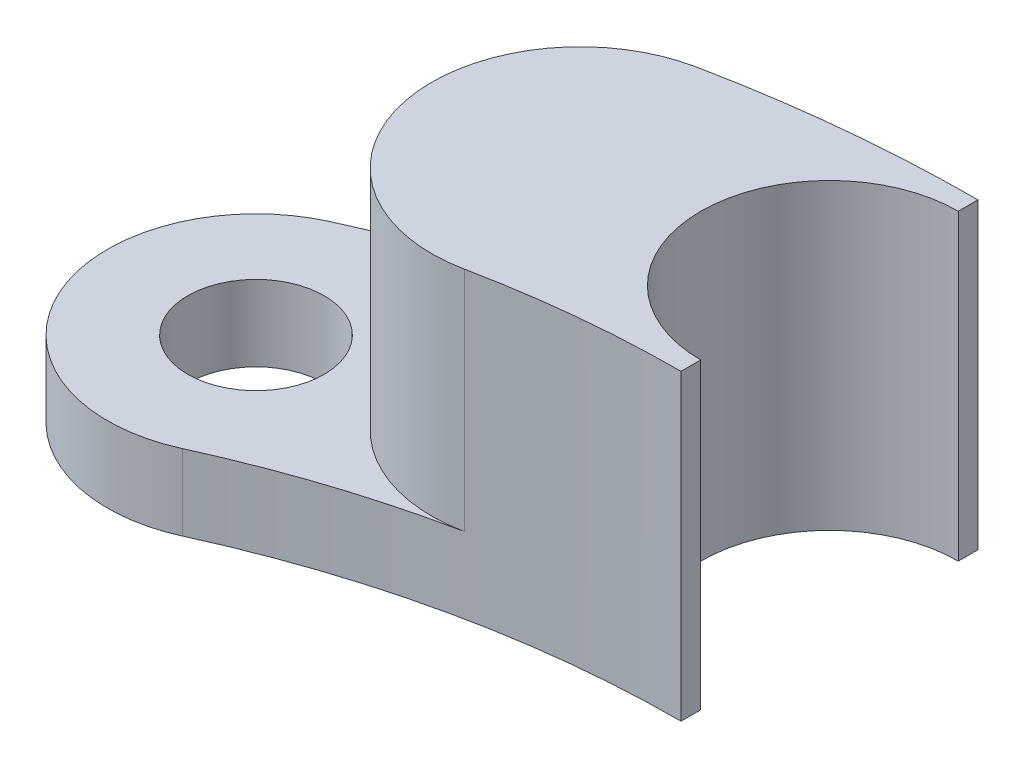
from build123d import *

# Parameters (mm, degrees)
SKETCH_1_R          = 4.9
SKETCH_1_R_2        = 2.25
EXTRUDE_1_DEPTH     = 10
CUT_EXTRUDE_START   = -7.5
SKETCH_2_R          = 2.25
CUT_EXTRUDE_1_DEPTH = 7.5


with BuildPart() as part:
    # ｽｹｯﾁ1 → ﾎﾞｽ - 押し出し1 (new body)
    # profile 1 of 2: a face of its own
    with BuildSketch(Plane(origin=(0, 0, 0), x_dir=(1, 0, 0), z_dir=(0, 1, 0))):
        with BuildLine():
            ThreePointArc((-13.518999719, 29.664737427), (-6.916992117, 31.85773407), (0, 32.6))
            Line((0, 32.6), (0, 33.25))
            ThreePointArc((0, 33.25), (-4.25, 37.5), (0, 41.75))
            Line((0, 41.75), (0, 42.4))
            ThreePointArc((0, 42.4), (-8.996333347, 41.434598904), (-17.582993578, 38.582357844))
            ThreePointArc((-17.582993578, 38.582357844), (-12.900221731, 38.244638848), (-10.6509966, 34.123547658))
            ThreePointArc((-10.6509966, 34.123547658), (-11.429905439, 31.472772744), (-13.518999719, 29.664737427))
        make_face()
    # profile 2 of 2: a face of its own
    with BuildSketch(Plane(origin=(0, 0, 0), x_dir=(1, 0, 0), z_dir=(0, 1, 0))):
        with Locations((-15.5509966, 34.123547658)):
            Circle(SKETCH_1_R)
        with Locations(Location((-15.5509966, 34.123547658, 0), (0, 0, 270))):
            Circle(SKETCH_1_R_2, mode=Mode.SUBTRACT)
    extrude(amount=EXTRUDE_1_DEPTH)

    # ｽｹｯﾁ2 → ｶｯﾄ - 押し出し1 (cut)
    with BuildSketch(Plane(origin=(0, 10, 0), x_dir=(1, 0, 0), z_dir=(0, 1, 0)).offset(CUT_EXTRUDE_START)):
        with BuildLine():
            ThreePointArc((-6.499394652, 31.945545373), (-12.27792858, 35.770273479), (-8.453200542, 41.548807451))
            ThreePointArc((-8.453200542, 41.548807451), (-13.102320652, 40.324796262), (-17.582993548, 38.582357858))
            ThreePointArc((-17.582993489, 38.582357885), (-20.009806827, 32.091550769), (-13.518999711, 29.664737431))
            ThreePointArc((-13.518999716, 29.664737428), (-10.073954015, 31.004442432), (-6.499394652, 31.945545373))
        make_face()
        with Locations(Location((-15.5509966, 34.123547658, 0), (0, 0, 270))):
            Circle(SKETCH_2_R, mode=Mode.SUBTRACT)
    extrude(amount=CUT_EXTRUDE_1_DEPTH, mode=Mode.SUBTRACT)


solid = part.part
